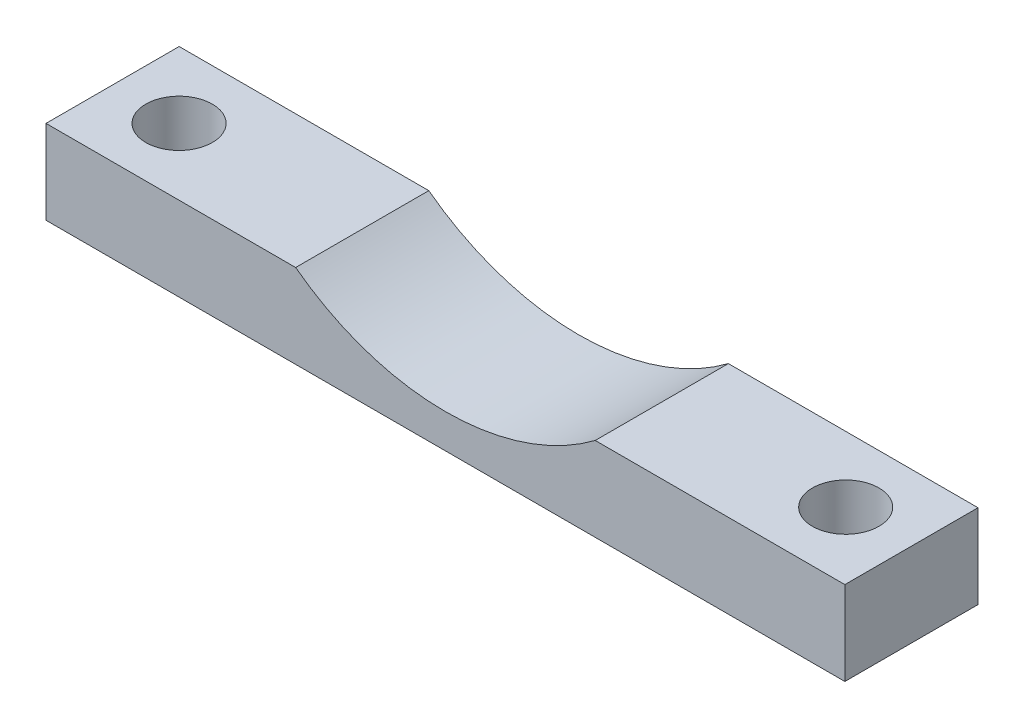
from build123d import *

# Parameters (mm, degrees)
BOSS_EXTRUDE1_DEPTH = 10.16
SKETCH2_R           = 2.54
CUT_EXTRUDE1_DEPTH  = 33.773906903


with BuildPart() as part:
    # Sketch1 → Boss-Extrude1 (new body)
    with BuildSketch(Plane.XY):
        with BuildLine():
            Line((-11.415908645, -15.267119982), (-30.465908645, -15.267119982))
            Line((-30.465908645, -15.267119982), (-30.465908645, -21.671319081))
            Line((-30.465908645, -21.671319081), (30.494091355, -21.671319081))
            Line((30.494091355, -21.671319081), (30.494091355, -15.267119982))
            Line((30.494091355, -15.267119982), (11.444091355, -15.267119982))
            ThreePointArc((11.444091355, -15.267119982), (0.014091355, -19.077119982), (-11.415908645, -15.267119982))
        make_face()
    extrude(amount=BOSS_EXTRUDE1_DEPTH)

    # Sketch2 → Cut-Extrude1 (cut, through all)
    with BuildSketch(Plane(origin=(0, -15.267119982, 0), x_dir=(1, 0, 0), z_dir=(0, 1, 0))):
        with Locations(Location((-25.392954322, -5.08, 0), (0, 0, 180))):
            Circle(SKETCH2_R)
        with Locations((25.406947958, -5.00954336)):
            Circle(SKETCH2_R)
    extrude(amount=-CUT_EXTRUDE1_DEPTH, mode=Mode.SUBTRACT)


solid = part.part
